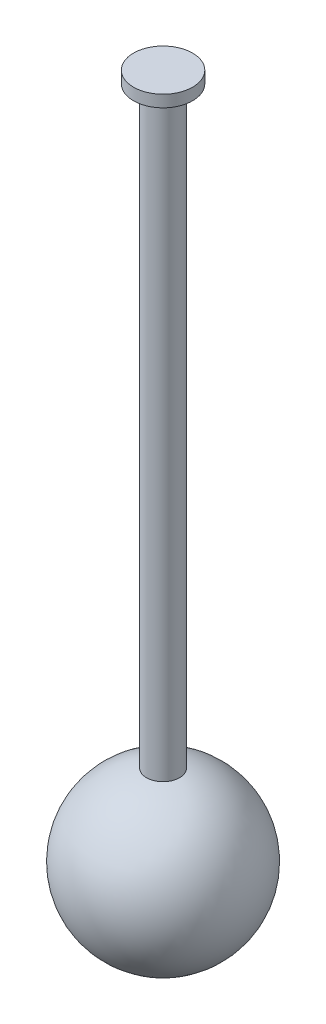
from build123d import *

# Parameters (mm, degrees)
SKETCH3_R           = 0.7
BOSS_EXTRUDE1_DEPTH = 28.5
SKETCH4_R           = 1.25
BOSS_EXTRUDE3_DEPTH = 0.5


with BuildPart() as part:
    # Sketch1 → Revolve-Thin1 (revolve)
    with BuildSketch(Plane.XY):
        with BuildLine():
            ThreePointArc((0, -3.46), (3.46, 0), (0, 3.46))
            Line((0, 3.46), (0, 3.488))
            ThreePointArc((0, 3.488), (3.488, 0), (0, -3.488))
            Line((0, -3.488), (0, -3.46))
        make_face()
    revolve(axis=Axis((0, 3.46, 0), (0, -1, 0)))

    # Sketch3 → Boss-Extrude1 (add)
    with BuildSketch(Plane(origin=(0, 0, 0), x_dir=(1, 0, 0), z_dir=(0, 1, 0))):
        with Locations(Location((0, 0, 0), (0, 0, 90))):
            Circle(SKETCH3_R)
    extrude(amount=BOSS_EXTRUDE1_DEPTH)

    # Sketch4 → Boss-Extrude3 (add)
    with BuildSketch(Plane(origin=(0, 28.5, 0), x_dir=(1, 0, 0), z_dir=(0, 1, 0))):
        with Locations(Location((0, 0, 0), (0, 0, 270))):
            Circle(SKETCH4_R)
    extrude(amount=BOSS_EXTRUDE3_DEPTH)


solid = part.part
